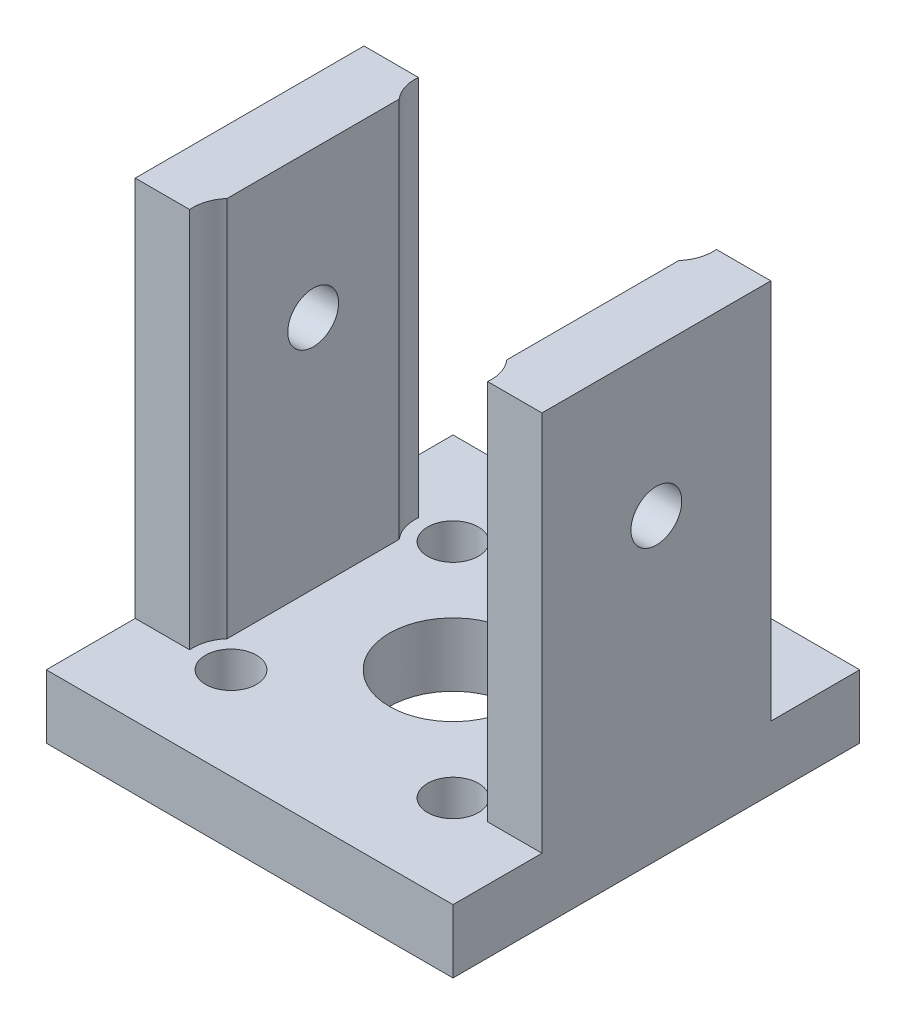
from build123d import *

# Parameters (mm, degrees)
SKETCH1_W           = 32
SKETCH1_H           = 32
BOSS_EXTRUDE1_DEPTH = 5
BOSS_EXTRUDE2_DEPTH = 30
SKETCH3_R           = 5
SKETCH3_R_2         = 2
CUT_EXTRUDE1_DEPTH  = 10
SKETCH4_R           = 2
CUT_EXTRUDE2_DEPTH  = 58.210138962


with BuildPart() as part:
    # Sketch1 → Boss-Extrude1 (new body)
    with BuildSketch(Plane(origin=(0, 0, 0), x_dir=(1, 0, 0), z_dir=(0, 1, 0))):
        with Locations((0, -16)):
            Rectangle(SKETCH1_W, SKETCH1_H)
    extrude(amount=BOSS_EXTRUDE1_DEPTH)

    # Sketch2 → Boss-Extrude2 (add)
    with BuildSketch(Plane(origin=(0, 5, 0), x_dir=(1, 0, 0), z_dir=(0, 1, 0))):
        with BuildLine():
            Line((-16, -7), (-11.720842953, -7))
            ThreePointArc((-11.720842953, -7), (-11.587559316, -8.18927833), (-11, -9.231833616))
            Line((-11, -9.231833616), (-11, -22.772628888))
            ThreePointArc((-11, -22.772628888), (-11.586870055, -23.813052847), (-11.721238688, -25))
            Line((-11.721238688, -25), (-16, -25))
            Line((-16, -25), (-16, -7))
        make_face()
        with BuildLine():
            Line((16, -25), (11.725701193, -25))
            ThreePointArc((11.725701193, -25), (11.590282481, -23.809816196), (11, -22.767490763))
            Line((11, -22.767490763), (11, -9.236971742))
            ThreePointArc((11, -9.236971742), (11.590974158, -8.192515764), (11.725305458, -7))
            Line((11.725305458, -7), (16, -7))
            Line((16, -7), (16, -25))
        make_face()
    extrude(amount=BOSS_EXTRUDE2_DEPTH)

    # Sketch3 → Cut-Extrude1 (cut)
    with BuildSketch(Plane.XZ):
        with Locations(Location((0, 16, 0), (0, 0, 270))):
            Circle(SKETCH3_R)
        with Locations(Location((-8.732768748, 7.267231252, 0), (0, 0, 270))):
            Circle(SKETCH3_R_2)
        with Locations(Location((-8.732768748, 24.732768748, 0), (0, 0, 270))):
            Circle(SKETCH3_R_2)
        with Locations(Location((8.732768748, 24.732768748, 0), (0, 0, 270))):
            Circle(SKETCH3_R_2)
        with Locations(Location((8.732768748, 7.267231252, 0), (0, 0, 270))):
            Circle(SKETCH3_R_2)
    extrude(amount=-CUT_EXTRUDE1_DEPTH, mode=Mode.SUBTRACT)

    # Sketch4 → Cut-Extrude2 (cut, through all)
    with BuildSketch(Plane.ZY.offset(16)):
        with Locations((16, 23.5)):
            Circle(SKETCH4_R)
    extrude(amount=-CUT_EXTRUDE2_DEPTH, mode=Mode.SUBTRACT)


solid = part.part
